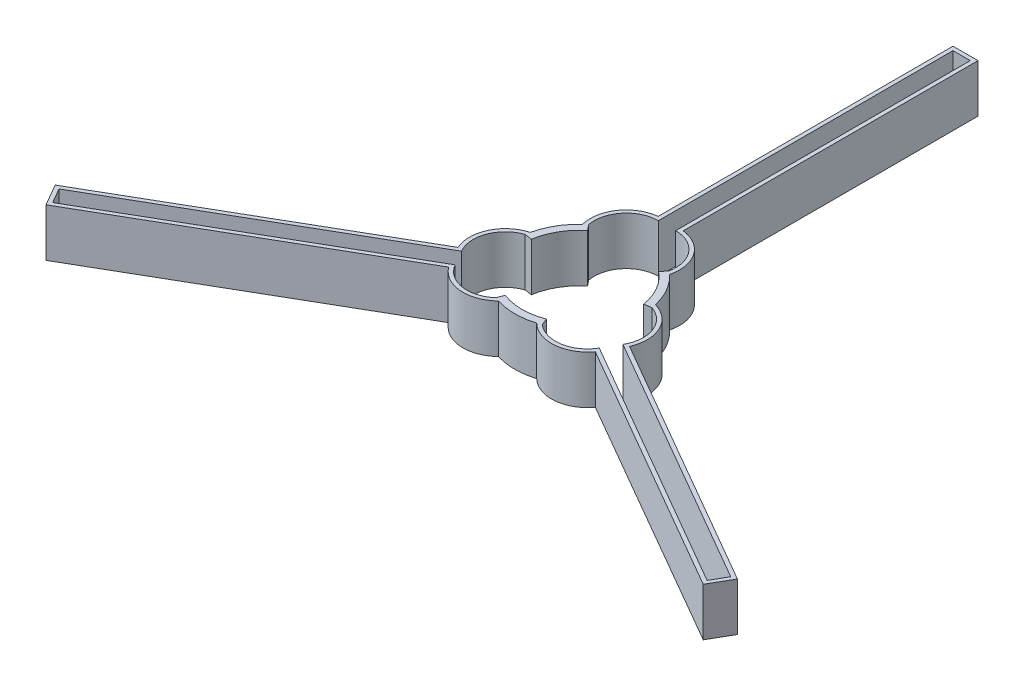
from build123d import *

# Parameters (mm, degrees)
BOSS_EXTRUDE1_DEPTH = 15


with BuildPart() as part:
    # Sketch1 → Boss-Extrude1 (new body)
    with BuildSketch(Plane(origin=(0, 0, 0), x_dir=(1, 0, 0), z_dir=(0, 1, 0))):
        with BuildLine():
            ThreePointArc((12.518734156, 15.597477204), (13.041444472, 15.163137079), (13.549095916, 14.711288178))
            ThreePointArc((13.549095916, 14.711288178), (11.904160472, 23.874346891), (3.9, 28.62838441))
            Line((3.9, 28.62838441), (3.9, 120.5))
            Line((3.9, 120.5), (0, 120.5))
            Line((0, 120.5), (-3.9, 120.5))
            Line((-3.9, 120.5), (-3.9, 28.62838441))
            ThreePointArc((-3.9, 28.62838441), (-11.904160472, 23.874346891), (-13.549095916, 14.711288178))
            ThreePointArc((-13.549095916, 14.711288178), (-13.041444472, 15.163137079), (-12.518734156, 15.597477204))
            ThreePointArc((-12.518734156, 15.597477204), (-10.412126322, 23.858631961), (-2.7, 27.492855685))
            Line((-2.7, 27.492855685), (-2.7, 119.3))
            Line((-2.7, 119.3), (2.7, 119.3))
            Line((2.7, 119.3), (2.7, 27.492855685))
            ThreePointArc((2.7, 27.492855685), (10.412126322, 23.858631961), (12.518734156, 15.597477204))
        make_face()
        with BuildLine():
            ThreePointArc((-17.493953036, 2.692880832), (-15.328649647, 8.85), (-11.079079728, 13.803767326))
            Line((-11.079079728, 13.803767326), (-12.518734156, 15.597477204))
            ThreePointArc((-12.518734156, 15.597477204), (-13.041444472, 15.163137079), (-13.549095916, 14.711288178))
            ThreePointArc((-13.549095916, 14.711288178), (-17.320508076, 10), (-19.514897242, 4.378217173))
            ThreePointArc((-19.514897242, 4.378217173), (-19.652384148, 3.712653675), (-19.767178572, 3.0428032))
            Line((-19.767178572, 3.0428032), (-17.493953036, 2.692880832))
        make_face()
        with BuildLine():
            ThreePointArc((-22.842908169, -17.69169128), (-14.72371067, -22.246478824), (-5.965801326, -19.089505351))
            ThreePointArc((-5.965801326, -19.089505351), (-6.610939676, -18.875790754), (-7.248444416, -18.640280404))
            ThreePointArc((-7.248444416, -18.640280404), (-15.456118217, -20.946481882), (-22.459511445, -16.084696432))
            Line((-22.459511445, -16.084696432), (-101.966830671, -61.98826859))
            Line((-101.966830671, -61.98826859), (-104.666830671, -57.31173141))
            Line((-104.666830671, -57.31173141), (-25.159511445, -11.408159252))
            ThreePointArc((-25.159511445, -11.408159252), (-25.868244538, -2.912150078), (-19.767178572, 3.0428032))
            ThreePointArc((-19.767178572, 3.0428032), (-19.652384148, 3.712653675), (-19.514897242, 4.378217173))
            ThreePointArc((-19.514897242, 4.378217173), (-26.627871142, -1.627868066), (-26.742908169, -10.93669313))
            Line((-26.742908169, -10.93669313), (-106.306061156, -56.872500925))
            Line((-106.306061156, -56.872500925), (-104.356061156, -60.25))
            Line((-104.356061156, -60.25), (-102.406061156, -63.627499075))
            Line((-102.406061156, -63.627499075), (-22.842908169, -17.69169128))
        make_face()
        with BuildLine():
            Line((17.493953036, 2.692880832), (19.767178572, 3.0428032))
            ThreePointArc((19.767178572, 3.0428032), (19.652384148, 3.712653675), (19.514897242, 4.378217173))
            ThreePointArc((19.514897242, 4.378217173), (17.320508076, 10), (13.549095916, 14.711288178))
            ThreePointArc((13.549095916, 14.711288178), (13.041444472, 15.163137079), (12.518734156, 15.597477204))
            Line((12.518734156, 15.597477204), (11.079079728, 13.803767326))
            ThreePointArc((11.079079728, 13.803767326), (15.328649647, 8.85), (17.493953036, 2.692880832))
        make_face()
        with BuildLine():
            ThreePointArc((5.965801326, -19.089505351), (6.610939676, -18.875790754), (7.248444416, -18.640280404))
            Line((7.248444416, -18.640280404), (6.414873308, -16.496648158))
            ThreePointArc((6.414873308, -16.496648158), (0, -17.7), (-6.414873308, -16.496648158))
            Line((-6.414873308, -16.496648158), (-7.248444416, -18.640280404))
            ThreePointArc((-7.248444416, -18.640280404), (-6.610939676, -18.875790754), (-5.965801326, -19.089505351))
            ThreePointArc((-5.965801326, -19.089505351), (0, -20), (5.965801326, -19.089505351))
        make_face()
        with BuildLine():
            ThreePointArc((19.767178572, 3.0428032), (25.868244538, -2.912150078), (25.159511445, -11.408159252))
            Line((25.159511445, -11.408159252), (104.666830671, -57.31173141))
            Line((104.666830671, -57.31173141), (101.966830671, -61.98826859))
            Line((101.966830671, -61.98826859), (22.459511445, -16.084696432))
            ThreePointArc((22.459511445, -16.084696432), (15.456118217, -20.946481882), (7.248444416, -18.640280404))
            ThreePointArc((7.248444416, -18.640280404), (6.610939676, -18.875790754), (5.965801326, -19.089505351))
            ThreePointArc((5.965801326, -19.089505351), (14.72371067, -22.246478824), (22.842908169, -17.69169128))
            Line((22.842908169, -17.69169128), (102.406061156, -63.627499075))
            Line((102.406061156, -63.627499075), (104.356061156, -60.25))
            Line((104.356061156, -60.25), (106.306061156, -56.872500925))
            Line((106.306061156, -56.872500925), (26.742908169, -10.93669313))
            ThreePointArc((26.742908169, -10.93669313), (26.627871142, -1.627868066), (19.514897242, 4.378217173))
            ThreePointArc((19.514897242, 4.378217173), (19.652384148, 3.712653675), (19.767178572, 3.0428032))
        make_face()
    extrude(amount=BOSS_EXTRUDE1_DEPTH)


solid = part.part
